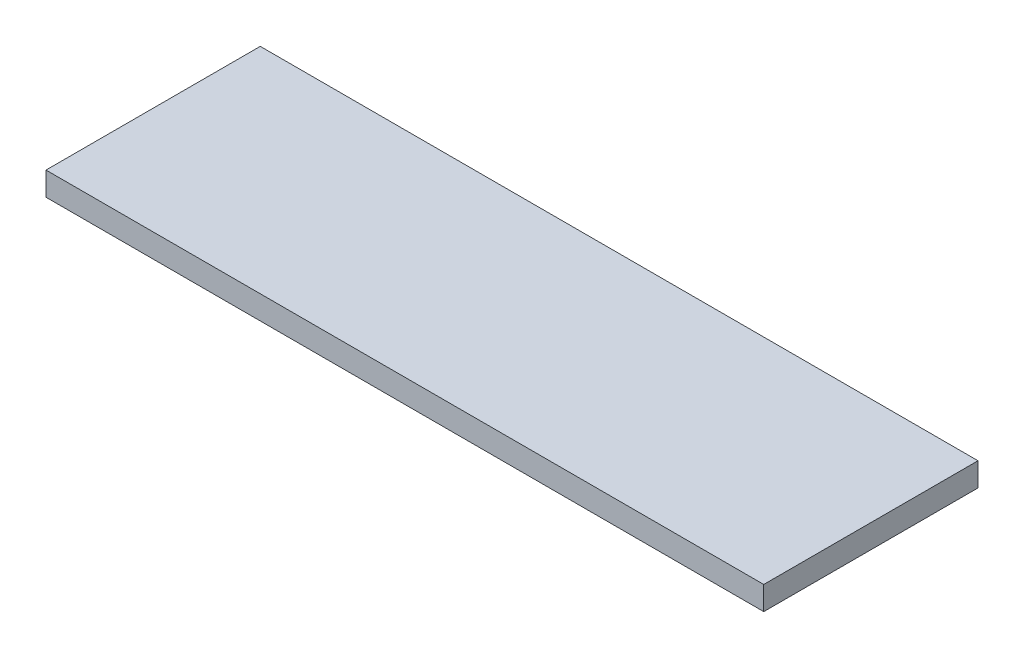
from build123d import *

# Parameters (mm, degrees)
CROQUIS1_W              = 670
CROQUIS1_H              = 200
SALIENTE_EXTRUIR1_DEPTH = 22


with BuildPart() as part:
    # Croquis1 → Saliente-Extruir1 (new body)
    with BuildSketch(Plane(origin=(0, 0, 0), x_dir=(1, 0, 0), z_dir=(0, 1, 0))):
        with Locations((53.072289157, 30.722891566)):
            Rectangle(CROQUIS1_W, CROQUIS1_H)
    extrude(amount=SALIENTE_EXTRUIR1_DEPTH)


solid = part.part
